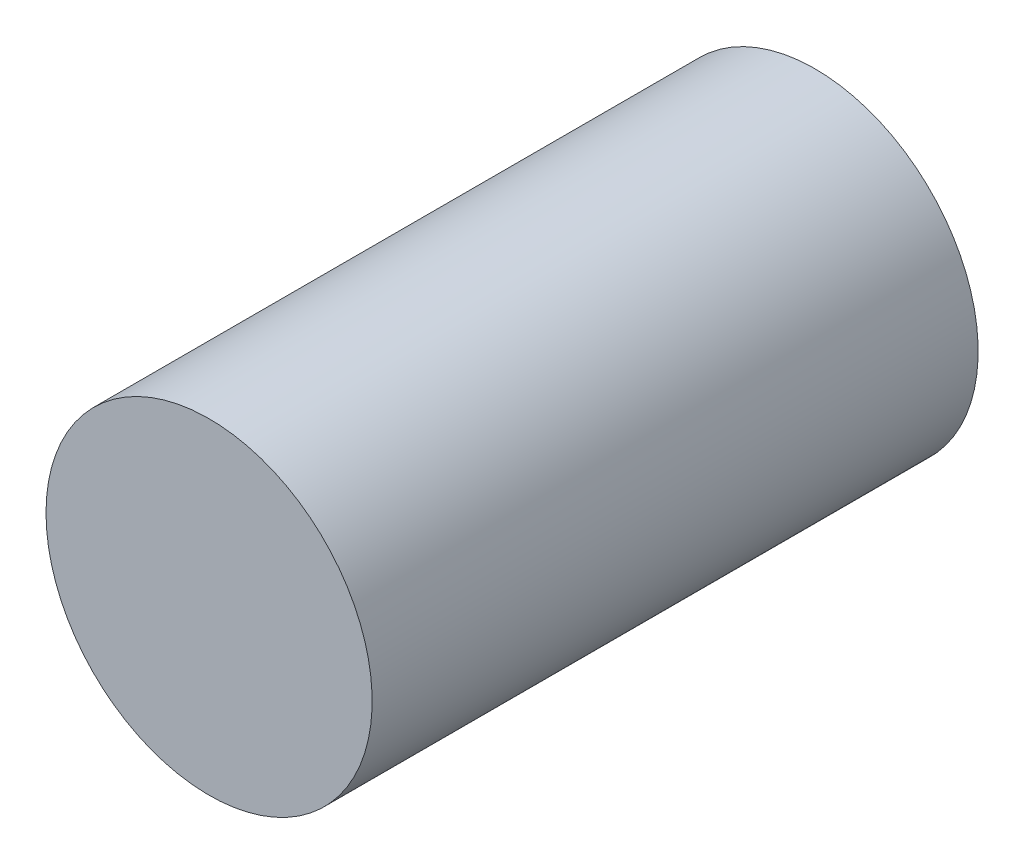
from build123d import *

# Parameters (mm, degrees)
SKETCH1_R           = 6.72770575
BOSS_EXTRUDE1_DEPTH = 12.5


with BuildPart() as part:
    # Sketch1 → Boss-Extrude1 (new, symmetric)
    with BuildSketch(Plane.XY):
        with Locations(Location((0, 0, 0), (0, 0, 180))):
            Circle(SKETCH1_R)
    extrude(amount=BOSS_EXTRUDE1_DEPTH, both=True)


solid = part.part
